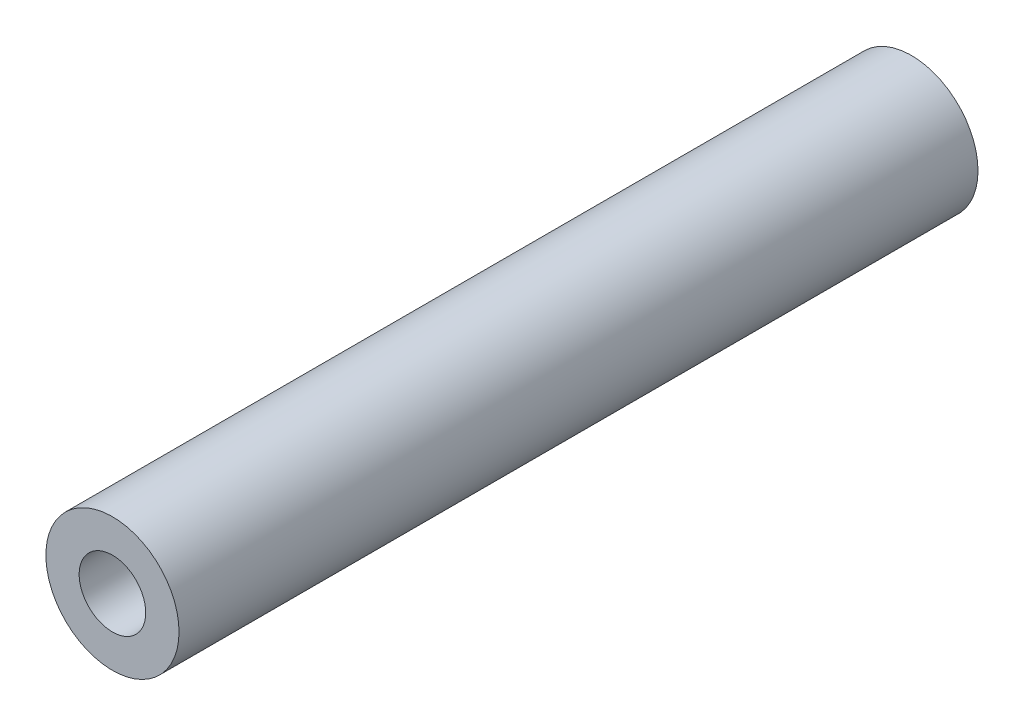
from build123d import *

# Parameters (mm, degrees)
SKETCH_1_R      = 5
SKETCH_1_R_2    = 2.5
EXTRUDE_1_DEPTH = 60


with BuildPart() as part:
    # 草图1 → 凸台-拉伸1 (new body)
    with BuildSketch(Plane.XY):
        Circle(SKETCH_1_R)
        Circle(SKETCH_1_R_2, mode=Mode.SUBTRACT)
    extrude(amount=EXTRUDE_1_DEPTH)


solid = part.part
